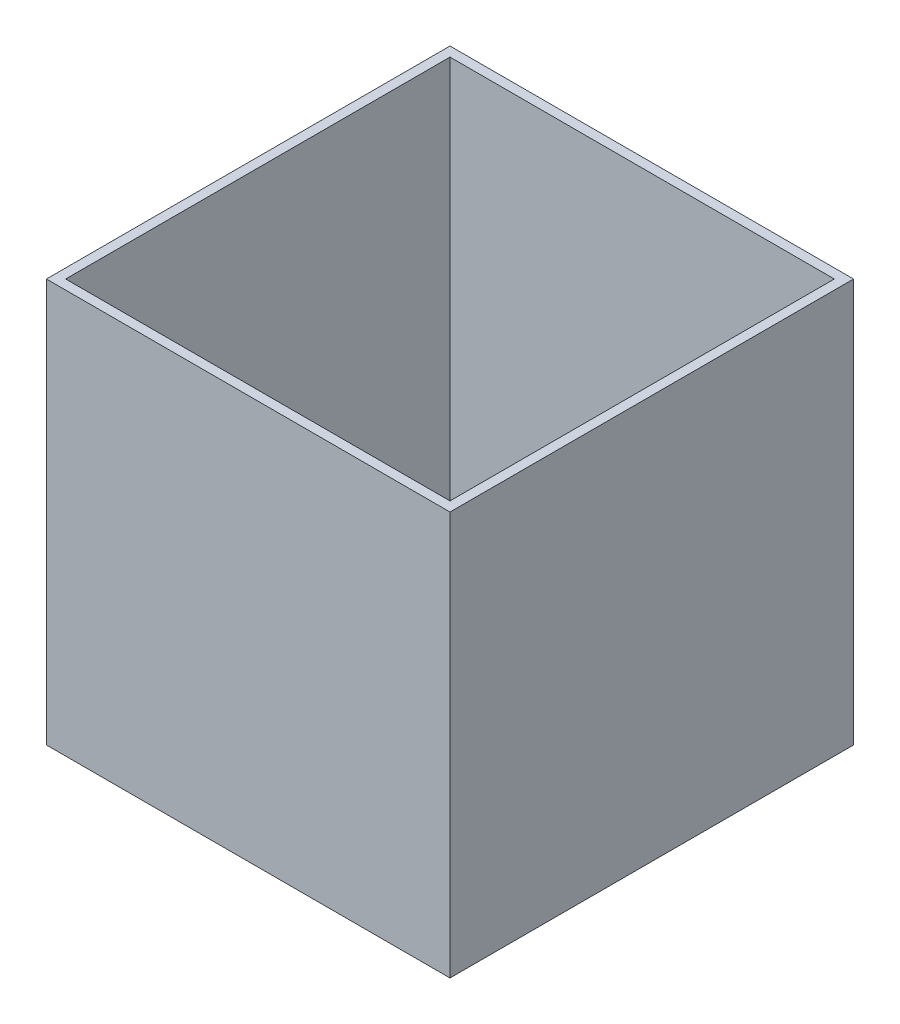
from build123d import *

# Parameters (mm, degrees)
SKETCH_1_W          = 210
SKETCH_1_H          = 210
EXTRUDE_1_DEPTH     = 210
CUT_EXTRUDE_START   = 210
SKETCH_2_W          = 200
SKETCH_2_H          = 200
CUT_EXTRUDE_1_DEPTH = 200


with BuildPart() as part:
    # 草图1 → 凸台-拉伸1 (new body)
    with BuildSketch(Plane(origin=(0, 0, 0), x_dir=(1, 0, 0), z_dir=(0, 1, 0))):
        Rectangle(SKETCH_1_W, SKETCH_1_H)
    extrude(amount=EXTRUDE_1_DEPTH)

    # 草图2 → 切除-拉伸1 (cut)
    with BuildSketch(Plane(origin=(0, 0, 0), x_dir=(1, 0, 0), z_dir=(0, 1, 0)).offset(CUT_EXTRUDE_START)):
        Rectangle(SKETCH_2_W, SKETCH_2_H)
    extrude(amount=-CUT_EXTRUDE_1_DEPTH, mode=Mode.SUBTRACT)


solid = part.part
